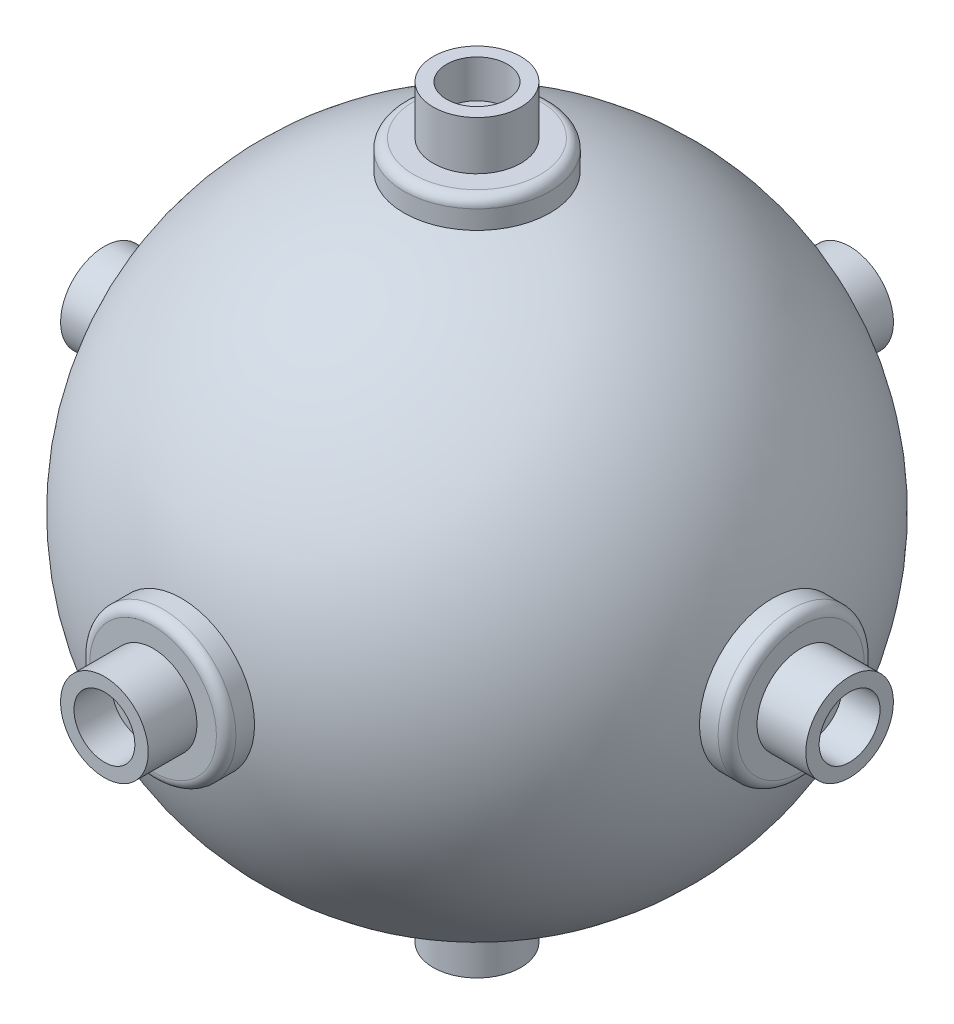
from build123d import *

# Parameters (mm, degrees)
SKETCH6_R           = 3.81
BOSS_EXTRUDE1_DEPTH = 1.016
SKETCH9_R           = 2.286
BOSS_EXTRUDE3_DEPTH = 2.54
CIRPATTERN1_COUNT   = 4
SKETCH10_R          = 3.81
BOSS_EXTRUDE4_DEPTH = 1.016
SKETCH11_R          = 2.286
BOSS_EXTRUDE5_DEPTH = 2.54
CIRPATTERN2_COUNT   = 4
FILLET1_R           = 0.508


with BuildPart() as part:
    # Sketch1 → Revolve1 (revolve)
    with BuildSketch(Plane.XY):
        with BuildLine():
            Line((0, 15.875), (0, -15.875))
            ThreePointArc((0, -15.875), (-15.875, 0), (0, 15.875))
        make_face()
    revolve(axis=Axis((0, 15.875, 0), (0, -1, 0)))

    # Sketch6 → Boss-Extrude1 (add, symmetric)
    with BuildSketch(Plane.XY.offset(15.875)):
        with Locations(Location((0, 0, 0), (0, 0, 180))):
            Circle(SKETCH6_R)
    boss_extrude1 = extrude(amount=BOSS_EXTRUDE1_DEPTH, both=True)

    # Sketch9 → Boss-Extrude3 (add)
    with BuildSketch(Plane.XY.offset(16.891)):
        Circle(SKETCH9_R)
    boss_extrude3 = extrude(amount=BOSS_EXTRUDE3_DEPTH)

    # CirPattern1: Boss-Extrude1, Boss-Extrude3 ×4 about axis
    cirpattern1_axis = Axis((0, 0, 0), (0, 1, 0))
    add([boss_extrude1.rotate(cirpattern1_axis, i * 360 / CIRPATTERN1_COUNT) for i in range(1, CIRPATTERN1_COUNT)])
    add([boss_extrude3.rotate(cirpattern1_axis, i * 360 / CIRPATTERN1_COUNT) for i in range(1, CIRPATTERN1_COUNT)])

    # Sketch10 → Boss-Extrude4 (add, symmetric)
    with BuildSketch(Plane(origin=(0, 15.875, 0), x_dir=(1, 0, 0), z_dir=(0, 1, 0))):
        with Locations(Location((0, 0, 0), (0, 0, 90))):
            Circle(SKETCH10_R)
    boss_extrude4 = extrude(amount=BOSS_EXTRUDE4_DEPTH, both=True)

    # Sketch11 → Boss-Extrude5 (add)
    with BuildSketch(Plane(origin=(0, 16.891, 0), x_dir=(1, 0, 0), z_dir=(0, 1, 0))):
        with Locations(Location((0, 0, 0), (0, 0, 270))):
            Circle(SKETCH11_R)
    boss_extrude5 = extrude(amount=BOSS_EXTRUDE5_DEPTH)

    # Mirror1: Boss-Extrude4, Boss-Extrude5 across plane
    add(boss_extrude4.mirror(Plane.ZX))
    add(boss_extrude5.mirror(Plane.ZX))

    # Sketch13 → CBORE for _00 Binding Head Machine Screw (revolve, cut)
    with BuildSketch(Plane(origin=(0, 19.431, 0), x_dir=(0, 0, 1), z_dir=(1, 0, 0))):
        Polygon((0, 0), (0, 4.229701142), (0.6985, 3.81), (0.6985, 1.9812), (1.5875, 1.9812), (1.5875, 0), align=None)
    cbore_for_00_binding_head_machine_screw = revolve(axis=Axis((0, 25.781, 0), (0, -1, 0)), mode=Mode.SUBTRACT)

    # CirPattern2: CBORE for _00 Binding Head Machine Screw ×4 about axis
    cirpattern2_axis = Axis((0, 0, 0), (1, 0, 0))
    for i in range(1, CIRPATTERN2_COUNT):
        add(cbore_for_00_binding_head_machine_screw.rotate(cirpattern2_axis, i * 360 / CIRPATTERN2_COUNT), mode=Mode.SUBTRACT)

    # Sketch19 → CBORE for _00 Binding Head Machine S 2 (revolve, cut)
    with BuildSketch(Plane(origin=(19.431, 0, 0), x_dir=(0, 0, -1), z_dir=(0, 1, 0))):
        Polygon((0, 0), (0, 4.229701142), (0.6985, 3.81), (0.6985, 1.9812), (1.5875, 1.9812), (1.5875, 0), align=None)
    cbore_for_00_binding_head_machine_s_2 = revolve(axis=Axis((25.781, 0, 0), (-1, 0, 0)), mode=Mode.SUBTRACT)

    # Mirror2: CBORE for _00 Binding Head Machine S 2 across plane
    add(cbore_for_00_binding_head_machine_s_2.mirror(Plane(origin=(0, 0, 0), x_dir=(0, 0, 1), z_dir=(1, 0, 0))), mode=Mode.SUBTRACT)

    # Fillet1
    fillet1_edges = [part.edges().sort_by_distance(p)[0] for p in [
        (-16.891, 0, 3.81),
        (-3.81, 0, -16.891),
        (16.891, 0, -3.81),
        (0, 16.891, 3.81),
        (0, -16.891, 3.81),
        (3.81, 0, 16.891),
    ]]
    fillet(fillet1_edges, radius=FILLET1_R)


solid = part.part
